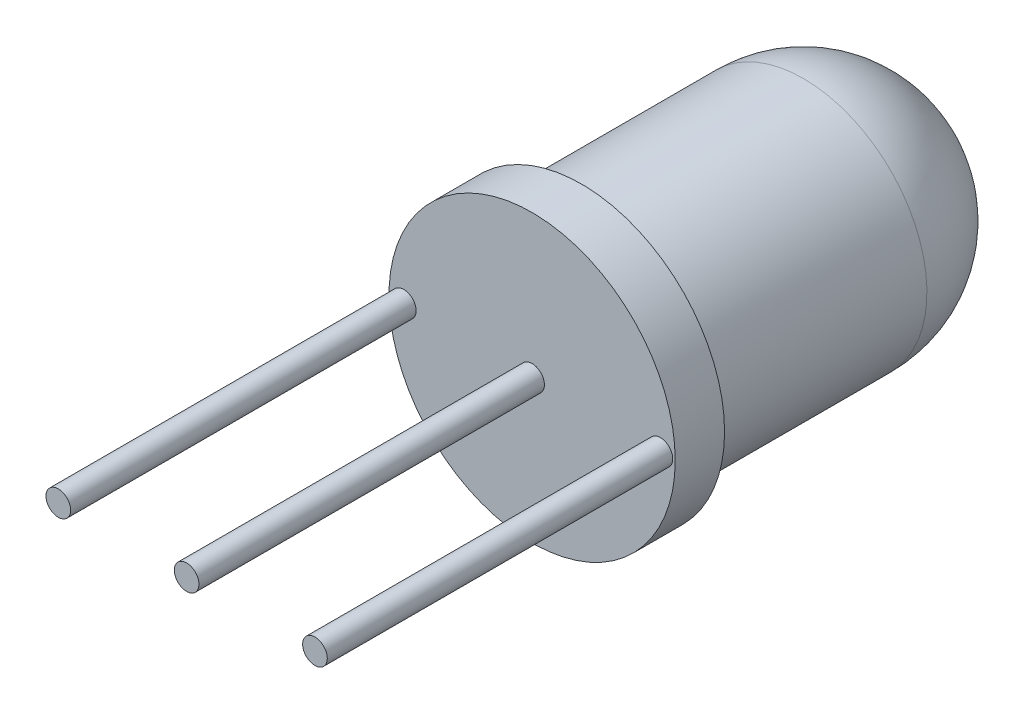
from build123d import *

# Parameters (mm, degrees)
SKETCH_1_R        = 2.5
EXTRUDE_1_DEPTH   = 5.5
SKETCH_2_R        = 2.9
EXTRUDE_2_DEPTH   = 1
EXTRUDE_1_2_DEPTH = 7


with BuildPart() as part:
    # 草图1 → Extrude 1 (new body)
    with BuildSketch(Plane.XY):
        Circle(SKETCH_1_R)
    extrude(amount=EXTRUDE_1_DEPTH)

    # 草图2 → 拉伸2 (add)
    with BuildSketch(Plane.XY.offset(5.5)):
        Circle(SKETCH_2_R)
    extrude(amount=-EXTRUDE_2_DEPTH)

    # 草图5 → 旋转2 (revolve)
    with BuildSketch(Plane(origin=(0, 0, 0), x_dir=(0, 0, -1), z_dir=(1, 0, 0)), mode=Mode.PRIVATE) as revolve_2_sk:
        with BuildLine():
            Line((0, 2.5), (0, 0))
            Line((0, 0), (2.5, 0))
            ThreePointArc((2.5, 0), (1.767766953, 1.767766953), (0, 2.5))
        make_face()
    revolve(revolve_2_sk.sketch.rotate(Axis((0, 0, -2.5), (0, 0, 1)), 90), axis=Axis((0, 0, -2.5), (0, 0, 1)))

    # 草图6 → Extrude 1 2 (add)
    with BuildSketch(Plane.XY.offset(5.5)):
        with BuildLine():
            ThreePointArc((2.35, 0), (2.6, -0.25), (2.85, 0))
            Line((2.85, 0), (2.35, 0))
        make_face()
        with BuildLine():
            Line((2.35, 0), (2.85, 0))
            ThreePointArc((2.85, 0), (2.6, 0.25), (2.35, 0))
        make_face()
        with BuildLine():
            ThreePointArc((0, -0.25), (0.176776695, -0.176776695), (0.25, 0))
            Line((0.25, 0), (0, 0))
            Line((0, 0), (0, -0.25))
        make_face()
        with BuildLine():
            Line((0, 0), (0.25, 0))
            ThreePointArc((0.25, 0), (0.176776695, 0.176776695), (0, 0.25))
            Line((0, 0.25), (0, 0))
        make_face()
        with BuildLine():
            Line((0, -0.25), (0, 0))
            Line((0, 0), (-0.25, 0))
            ThreePointArc((-0.25, 0), (-0.176776695, -0.176776695), (0, -0.25))
        make_face()
        with BuildLine():
            Line((-0.25, 0), (0, 0))
            Line((0, 0), (0, 0.25))
            ThreePointArc((0, 0.25), (-0.176776695, 0.176776695), (-0.25, 0))
        make_face()
        with BuildLine():
            ThreePointArc((-2.85, 0), (-2.6, -0.25), (-2.35, 0))
            Line((-2.35, 0), (-2.85, 0))
        make_face()
        with BuildLine():
            Line((-2.85, 0), (-2.35, 0))
            ThreePointArc((-2.35, 0), (-2.6, 0.25), (-2.85, 0))
        make_face()
    extrude(amount=EXTRUDE_1_2_DEPTH)


solid = part.part
